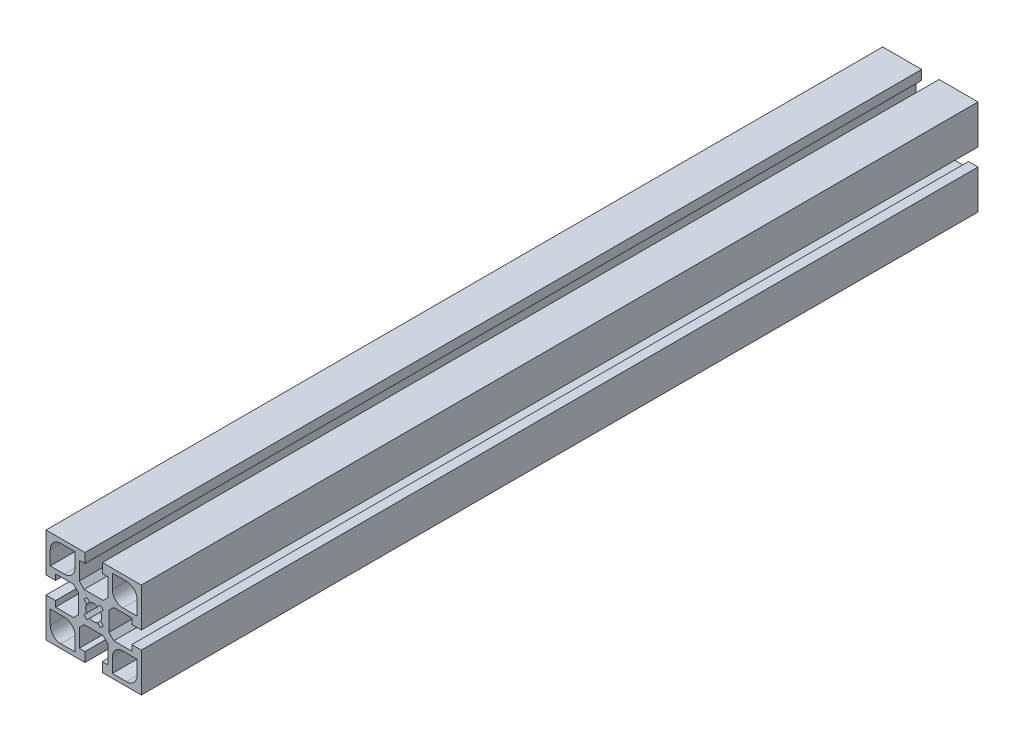
from build123d import *

# Parameters (mm, degrees)
BOSS_EXTRUDE1_DEPTH = 395


with BuildPart() as part:
    # Sketch1 → Boss-Extrude1 (new body)
    with BuildSketch(Plane.XY):
        Polygon((-17.999999991, -6.799999991), (-17.999999991, -4.099999991), (-22.499999991, -4.099999991), (-22.499999991, -22.499999991), (-4.099999991, -22.499999991), (-4.099999991, -17.999999991), (-6.799999991, -17.999999991), (-6.799999991, -9.499999991), (-4.499999991, -7.199999991), (4.500000009, -7.199999991), (6.800000009, -9.499999991), (6.800000009, -17.999999991), (4.100000009, -17.999999991), (4.100000009, -22.499999991), (22.500000009, -22.499999991), (22.500000009, -4.099999991), (18.000000009, -4.099999991), (18.000000009, -6.799999991), (9.500000009, -6.799999991), (7.200000009, -4.499999991), (7.200000009, 4.500000009), (9.500000009, 6.800000009), (18.000000009, 6.800000009), (18.000000009, 4.100000009), (22.500000009, 4.100000009), (22.500000009, 22.500000009), (4.100000009, 22.500000009), (4.100000009, 18.000000009), (6.800000009, 18.000000009), (6.800000009, 9.500000009), (4.500000009, 7.200000009), (-4.499999991, 7.200000009), (-6.799999991, 9.500000009), (-6.799999991, 18.000000009), (-4.099999991, 18.000000009), (-4.099999991, 22.500000009), (-22.499999991, 22.500000009), (-22.499999991, 4.100000009), (-17.999999991, 4.100000009), (-17.999999991, 6.800000009), (-9.499999991, 6.800000009), (-7.199999991, 4.500000009), (-7.199999991, -4.499999991), (-9.499999991, -6.799999991), align=None)
        with BuildLine():
            Line((-20.499999973, 8.799995438), (-20.499999973, 15.500000009))
            ThreePointArc((-20.499999973, 15.500000009), (-19.035533879, 19.035533915), (-15.499999973, 20.500000009))
            Line((-15.499999973, 20.500000009), (-8.799995402, 20.500000009))
            Line((-8.799995402, 20.500000009), (-8.799995402, 13.799995438))
            ThreePointArc((-8.799995402, 13.799995438), (-10.264461496, 10.264461532), (-13.799995402, 8.799995438))
            Line((-13.799995402, 8.799995438), (-20.499999973, 8.799995438))
        make_face(mode=Mode.SUBTRACT)
        with BuildLine():
            Line((20.500000009, 8.79999542), (13.799995438, 8.79999542))
            ThreePointArc((13.799995438, 8.79999542), (10.264461532, 10.264461514), (8.799995438, 13.79999542))
            Line((8.799995438, 13.79999542), (8.799995438, 20.499999991))
            Line((8.799995438, 20.499999991), (15.500000009, 20.499999991))
            ThreePointArc((15.500000009, 20.499999991), (19.035533915, 19.035533897), (20.500000009, 15.499999991))
            Line((20.500000009, 15.499999991), (20.500000009, 8.79999542))
        make_face(mode=Mode.SUBTRACT)
        with BuildLine():
            Line((15.499999991, -20.499999991), (8.79999542, -20.499999991))
            Line((8.79999542, -20.499999991), (8.79999542, -13.79999542))
            ThreePointArc((8.79999542, -13.79999542), (10.264461514, -10.264461514), (13.79999542, -8.79999542))
            Line((13.79999542, -8.79999542), (20.499999991, -8.79999542))
            Line((20.499999991, -8.79999542), (20.499999991, -15.499999991))
            ThreePointArc((20.499999991, -15.499999991), (19.035533897, -19.035533897), (15.499999991, -20.499999991))
        make_face(mode=Mode.SUBTRACT)
        with BuildLine():
            Line((-8.79999542, -20.499999973), (-15.499999991, -20.499999973))
            ThreePointArc((-15.499999991, -20.499999973), (-19.035533897, -19.035533879), (-20.499999991, -15.499999973))
            Line((-20.499999991, -15.499999973), (-20.499999991, -8.799995402))
            Line((-20.499999991, -8.799995402), (-13.79999542, -8.799995402))
            ThreePointArc((-13.79999542, -8.799995402), (-10.264461514, -10.264461496), (-8.79999542, -13.799995402))
            Line((-8.79999542, -13.799995402), (-8.79999542, -20.499999973))
        make_face(mode=Mode.SUBTRACT)
        with BuildLine():
            Line((-3.262737816, 1.848524254), (-4.596194076, 3.181980514))
            Line((-4.596194076, 3.181980514), (-3.181980513, 4.596194076))
            Line((-3.181980513, 4.596194076), (-1.848524253, 3.262737816))
            ThreePointArc((-1.848524253, 3.262737816), (2e-09, 3.749999997), (1.848524257, 3.262737816))
            Line((1.848524257, 3.262737816), (3.181980517, 4.596194076))
            Line((3.181980517, 4.596194076), (4.59619408, 3.181980513))
            Line((4.59619408, 3.181980513), (3.26273782, 1.848524253))
            ThreePointArc((3.26273782, 1.848524253), (3.75, -2e-09), (3.262737819, -1.848524257))
            Line((3.262737819, -1.848524257), (4.596194079, -3.181980517))
            Line((4.596194079, -3.181980517), (3.181980517, -4.596194079))
            Line((3.181980517, -4.596194079), (1.848524257, -3.262737819))
            ThreePointArc((1.848524257, -3.262737819), (2e-09, -3.75), (-1.848524253, -3.262737819))
            Line((-1.848524253, -3.262737819), (-3.181980515, -4.596194081))
            Line((-3.181980515, -4.596194081), (-4.596194078, -3.181980518))
            Line((-4.596194078, -3.181980518), (-3.262737816, -1.848524257))
            ThreePointArc((-3.262737816, -1.848524257), (-3.749999997, -2e-09), (-3.262737816, 1.848524254))
        make_face(mode=Mode.SUBTRACT)
    extrude(amount=BOSS_EXTRUDE1_DEPTH)


solid = part.part
